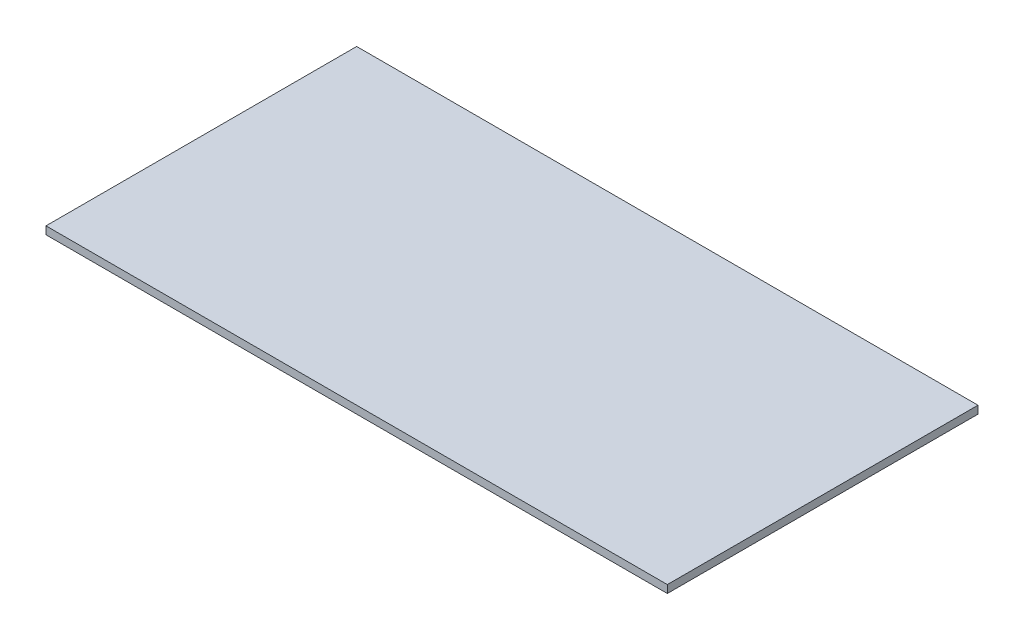
from build123d import *

# Parameters (mm, degrees)
SKETCH1_W           = 400
SKETCH1_H           = 200
BOSS_EXTRUDE1_DEPTH = 5


with BuildPart() as part:
    # Sketch1 → Boss-Extrude1 (new body)
    with BuildSketch(Plane(origin=(0, 0, 0), x_dir=(1, 0, 0), z_dir=(0, 1, 0))):
        Rectangle(SKETCH1_W, SKETCH1_H)
    extrude(amount=BOSS_EXTRUDE1_DEPTH)


solid = part.part
